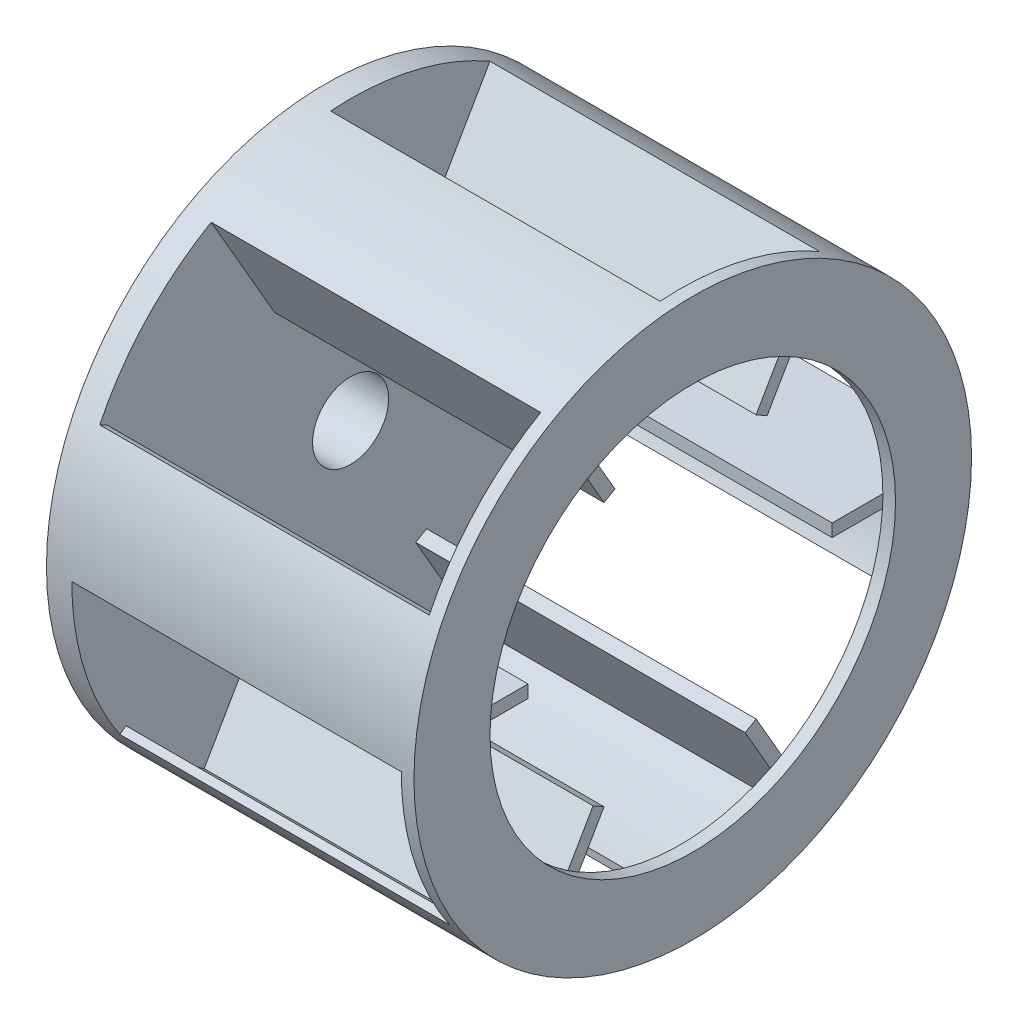
from build123d import *
from build123d.topology import SkipClean

# Parameters (mm, degrees)
SKETCH5_R           = 139.7
BOSS_EXTRUDE3_DEPTH = 12.7
SKETCH6_R           = 38.1
SKETCH6_R_2         = 19.05
BOSS_EXTRUDE4_DEPTH = 63.5
CUT_EXTRUDE3_START  = -63.5
SKETCH7_R           = 19.05
CUT_EXTRUDE3_DEPTH  = 63.5
BOSS_EXTRUDE5_DEPTH = 165.1
SKETCH10_R          = 139.7
BOSS_EXTRUDE6_DEPTH = 6.35
SKETCH11_R          = 101.6
CUT_EXTRUDE4_DEPTH  = 6.35


with BuildPart() as part:
    # Sketch5 → Boss-Extrude3 (new body)
    with BuildSketch(Plane(origin=(0, 0, 0), x_dir=(0, 0, -1), z_dir=(1, 0, 0))):
        Circle(SKETCH5_R)
    extrude(amount=BOSS_EXTRUDE3_DEPTH)

    # Sketch6 → Boss-Extrude4 (add)
    with BuildSketch(Plane.ZY):
        Circle(SKETCH6_R)
        Circle(SKETCH6_R_2, mode=Mode.SUBTRACT)
    extrude(amount=BOSS_EXTRUDE4_DEPTH)

    # Sketch7 → Cut-Extrude3 (cut)
    with BuildSketch(Plane.ZY.offset(CUT_EXTRUDE3_START)):
        with Locations(Location((0, 0, 0), (0, 0, 180))):
            Circle(SKETCH7_R)
    extrude(amount=CUT_EXTRUDE3_DEPTH, mode=Mode.SUBTRACT)

    # Sketch9 → Boss-Extrude5 (add)
    with SkipClean():  # the faces are left unmerged after this step: merging them gives an invalid solid
        with BuildSketch(Plane(origin=(12.7, 0, 0), x_dir=(0, 0, -1), z_dir=(1, 0, 0))):
            with BuildLine():
                Line((-139.7, 0), (-76.2, 0))
                Line((-76.2, 0), (-76.2, 6.35))
                Line((-76.2, 6.35), (-135.741554433, 6.35))
                ThreePointArc((-135.741554433, 6.35), (-131.694050685, 33.507747077), (-122.269799969, 59.297454545))
                Line((-122.269799969, 59.297454545), (-125.697925202, 60.96))
                ThreePointArc((-125.697925202, 60.96), (-136.154489736, 31.2737098), (-139.7, 0))
            make_face()
            with BuildLine():
                Line((-115.641871216, -78.377596428), (-112.488002001, -76.240025616))
                ThreePointArc((-112.488002001, -76.240025616), (-94.865585535, -97.296519882), (-73.370038531, -114.380634489))
                Line((-73.370038531, -114.380634489), (-43.599261314, -62.816135768))
                Line((-43.599261314, -62.816135768), (-38.1, -65.991135768))
                Line((-38.1, -65.991135768), (-69.85, -120.983748909))
                ThreePointArc((-69.85, -120.983748909), (-95.161072026, -102.276392051), (-115.641871216, -78.377596428))
            make_face()
            with BuildLine():
                Line((10.056053986, -139.337596428), (9.781797968, -135.537480161))
                ThreePointArc((9.781797968, -135.537480161), (36.82846515, -130.804266959), (62.371515903, -120.730634489))
                Line((62.371515903, -120.730634489), (32.600738686, -69.166135768))
                Line((32.600738686, -69.166135768), (38.1, -65.991135768))
                Line((38.1, -65.991135768), (69.85, -120.983748909))
                ThreePointArc((69.85, -120.983748909), (40.993417711, -133.550101851), (10.056053986, -139.337596428))
            make_face()
            with BuildLine():
                Line((125.697925202, -60.96), (122.269799969, -59.297454545))
                ThreePointArc((122.269799969, -59.297454545), (131.694050685, -33.507747077), (135.741554433, -6.35))
                Line((135.741554433, -6.35), (76.2, -6.35))
                Line((76.2, -6.35), (76.2, 0))
                Line((76.2, 0), (139.7, 0))
                ThreePointArc((139.7, 0), (136.154489736, -31.2737098), (125.697925202, -60.96))
            make_face()
            with BuildLine():
                Line((115.641871216, 78.377596428), (112.488002001, 76.240025616))
                ThreePointArc((112.488002001, 76.240025616), (94.865585535, 97.296519882), (73.370038531, 114.380634489))
                Line((73.370038531, 114.380634489), (43.599261314, 62.816135768))
                Line((43.599261314, 62.816135768), (38.1, 65.991135768))
                Line((38.1, 65.991135768), (69.85, 120.983748909))
                ThreePointArc((69.85, 120.983748909), (95.161072026, 102.276392051), (115.641871216, 78.377596428))
            make_face()
            with BuildLine():
                Line((-10.056053986, 139.337596428), (-9.781797968, 135.537480161))
                ThreePointArc((-9.781797968, 135.537480161), (-36.82846515, 130.804266959), (-62.371515903, 120.730634489))
                Line((-62.371515903, 120.730634489), (-32.600738686, 69.166135768))
                Line((-32.600738686, 69.166135768), (-38.1, 65.991135768))
                Line((-38.1, 65.991135768), (-69.85, 120.983748909))
                ThreePointArc((-69.85, 120.983748909), (-40.993417711, 133.550101851), (-10.056053986, 139.337596428))
            make_face()
        extrude(amount=BOSS_EXTRUDE5_DEPTH)

    # Sketch10 → Boss-Extrude6 (add)
    with SkipClean():  # the faces are left unmerged after this step: merging them gives an invalid solid
        with BuildSketch(Plane(origin=(177.8, 0, 0), x_dir=(0, 0, -1), z_dir=(1, 0, 0))):
            Circle(SKETCH10_R)
        extrude(amount=BOSS_EXTRUDE6_DEPTH)

    # Sketch11 → Cut-Extrude4 (cut)
    with SkipClean():  # the faces are left unmerged after this step: merging them gives an invalid solid
        with BuildSketch(Plane(origin=(184.15, 0, 0), x_dir=(0, 0, -1), z_dir=(1, 0, 0))):
            Circle(SKETCH11_R)
        extrude(amount=-CUT_EXTRUDE4_DEPTH, mode=Mode.SUBTRACT)


solid = part.part
